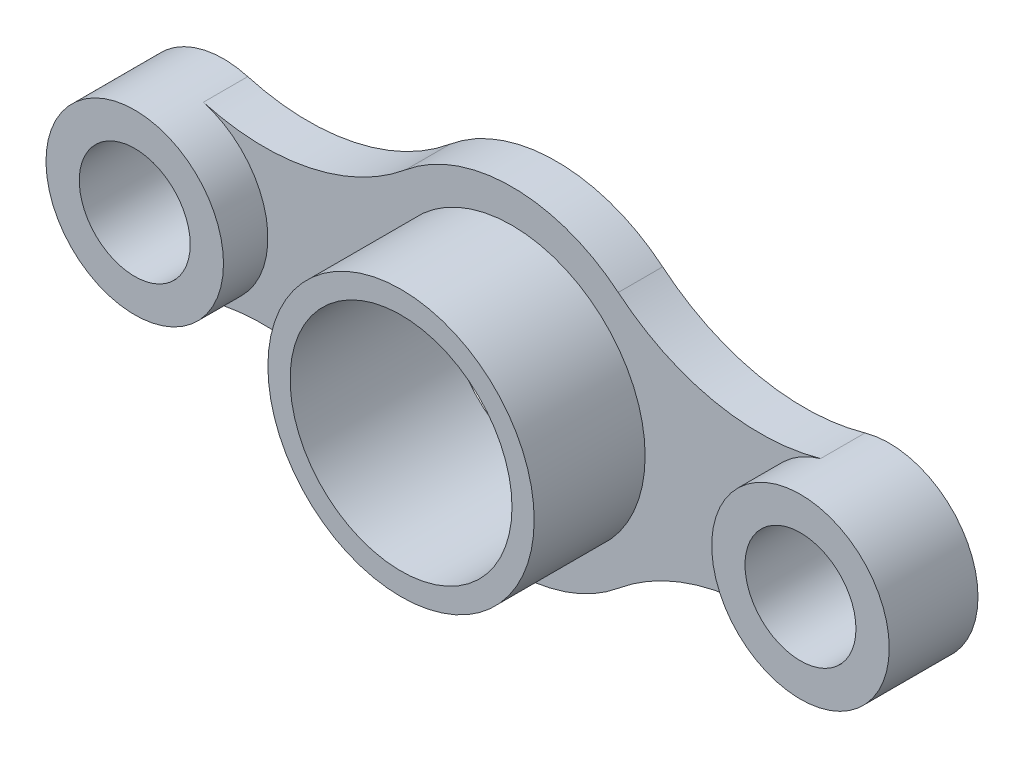
from build123d import *

# Parameters (mm, degrees)
SKETCH2_R           = 60
BOSS_EXTRUDE1_DEPTH = 20
SKETCH2_5_R         = 40
SKETCH2_5_R_2       = 25
BOSS_EXTRUDE4_DEPTH = 40
SKETCH2_6_R         = 60
SKETCH2_6_R_2       = 50
BOSS_EXTRUDE5_DEPTH = 70


with BuildPart() as part:
    # Sketch2 → Boss-Extrude1 (new body)
    with BuildSketch(Plane.XY):
        with BuildLine():
            ThreePointArc((-139.071428571, -38.478127898), (-91.104177178, -36.827906099), (-47.892857143, -57.717191847))
            ThreePointArc((-47.892857143, -57.717191847), (0, -75), (47.892857143, -57.717191847))
            ThreePointArc((47.892857143, -57.717191847), (91.104177178, -36.827906099), (139.071428571, -38.478127898))
            ThreePointArc((139.071428571, -38.478127898), (110, 0), (139.071428571, 38.478127898))
            ThreePointArc((139.071428571, 38.478127898), (91.104177178, 36.827906099), (47.892857143, 57.717191847))
            ThreePointArc((47.892857143, 57.717191847), (0, 75), (-47.892857143, 57.717191847))
            ThreePointArc((-47.892857143, 57.717191847), (-91.104177178, 36.827906099), (-139.071428571, 38.478127898))
            ThreePointArc((-139.071428571, 38.478127898), (-118.084934144, 24.112830017), (-110, 0))
            ThreePointArc((-110, 0), (-118.084934144, -24.112830017), (-139.071428571, -38.478127898))
        make_face()
        Circle(SKETCH2_R, mode=Mode.SUBTRACT)
    extrude(amount=BOSS_EXTRUDE1_DEPTH)

    # Sketch2<5> → Boss-Extrude4 (add)
    # profile 1 of 2: a face of its own
    with BuildSketch(Plane.XY):
        with Locations((-150, 0)):
            Circle(SKETCH2_5_R)
        with Locations((-150, 0)):
            Circle(SKETCH2_5_R_2, mode=Mode.SUBTRACT)
    # profile 2 of 2: a face of its own
    with BuildSketch(Plane.XY):
        with Locations((150, 0)):
            Circle(SKETCH2_5_R)
        with Locations((150, 0)):
            Circle(SKETCH2_5_R_2, mode=Mode.SUBTRACT)
    extrude(amount=BOSS_EXTRUDE4_DEPTH)

    # Sketch2<6> → Boss-Extrude5 (add)
    with BuildSketch(Plane.XY):
        Circle(SKETCH2_6_R)
        Circle(SKETCH2_6_R_2, mode=Mode.SUBTRACT)
    extrude(amount=BOSS_EXTRUDE5_DEPTH)


solid = part.part
